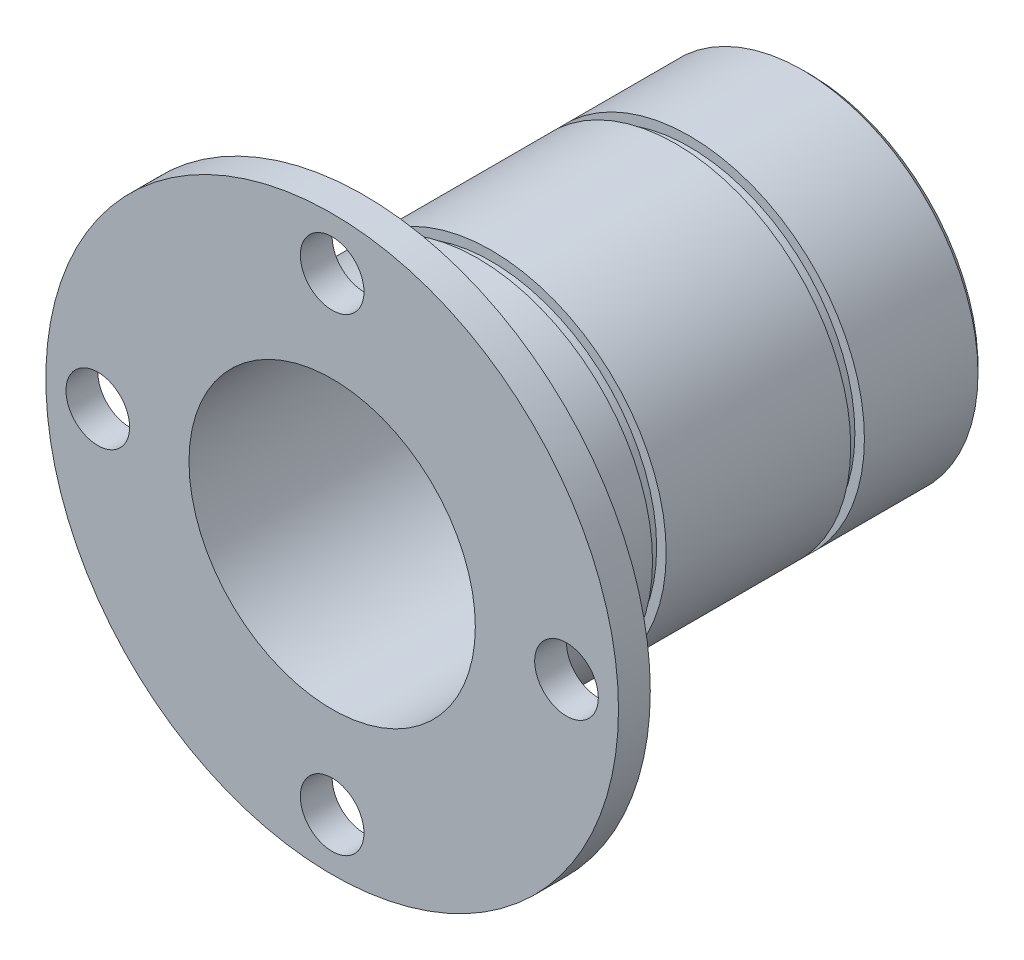
from build123d import *
from build123d.topology import SkipClean

# Parameters (mm, degrees)
SZKIC1_R                    = 45
SZKIC1_R_2                  = 22.5
SZKIC1_R_3                  = 5
DODANIE_WYCI_GNI_CIE1_DEPTH = 5
DODANIE_WYCI_GNI_CIE2_START = 70
SZKIC2_R                    = 27.5
SZKIC2_R_2                  = 22.5
DODANIE_WYCI_GNI_CIE2_DEPTH = 70
SFAZOWANIE1_SIZE            = 1


with BuildPart() as part:
    # Szkic1 → Dodanie-wyciągnięcie1 (new body)
    with BuildSketch(Plane.XY):
        Circle(SZKIC1_R)
        Circle(SZKIC1_R_2, mode=Mode.SUBTRACT)
        with Locations((0, 36.83)):
            Circle(SZKIC1_R_3, mode=Mode.SUBTRACT)
        with Locations((36.83, 0)):
            Circle(SZKIC1_R_3, mode=Mode.SUBTRACT)
        with Locations((0, -36.83)):
            Circle(SZKIC1_R_3, mode=Mode.SUBTRACT)
        with Locations((-36.83, 0)):
            Circle(SZKIC1_R_3, mode=Mode.SUBTRACT)
    extrude(amount=DODANIE_WYCI_GNI_CIE1_DEPTH)

    # Szkic2 → Dodanie-wyciągnięcie2 (add)
    with SkipClean():  # the faces are left unmerged after this step: merging them gives an invalid solid
        with BuildSketch(Plane(origin=(0, 0, 0), x_dir=(-1, 0, 0), z_dir=(0, 0, -1)).offset(DODANIE_WYCI_GNI_CIE2_START)):
            with Locations(Location((0, 0, 0), (0, 0, 180))):
                Circle(SZKIC2_R)
            Circle(SZKIC2_R_2, mode=Mode.SUBTRACT)
        extrude(amount=-DODANIE_WYCI_GNI_CIE2_DEPTH)

    # Szkic3 → Wycięcie-obrót1 (revolve, cut)
    with SkipClean():  # the faces are left unmerged after this step: merging them gives an invalid solid
        with BuildSketch(Plane(origin=(0, 0, 0), x_dir=(1, 0, 0), z_dir=(0, 1, 0))):
            Polygon((28.367830339, 17.85), (27.5, 17.85), (26, 17.85), (26, 20), (27.5, 20), (28.367830339, 20), align=None)
        revolve(axis=Axis((0, 0, 0), (0, 0, -1)), mode=Mode.SUBTRACT)

    # Szkic4 → Wycięcie-obrót2 (revolve, cut)
    with SkipClean():  # the faces are left unmerged after this step: merging them gives an invalid solid
        with BuildSketch(Plane(origin=(0, 0, 0), x_dir=(1, 0, 0), z_dir=(0, 1, 0))):
            Polygon((27.5, 49), (26, 49), (26, 51.15), (28.767264964, 51.15), (28.767264964, 49), align=None)
        revolve(axis=Axis((0, 0, 0), (0, 0, -1)), mode=Mode.SUBTRACT)

    # Sfazowanie1
    sfazowanie1_edges = [part.edges().sort_by_distance(p)[0] for p in [
        (-27.5, 0, -70),
    ]]
    chamfer(sfazowanie1_edges, length=SFAZOWANIE1_SIZE)


solid = part.part
